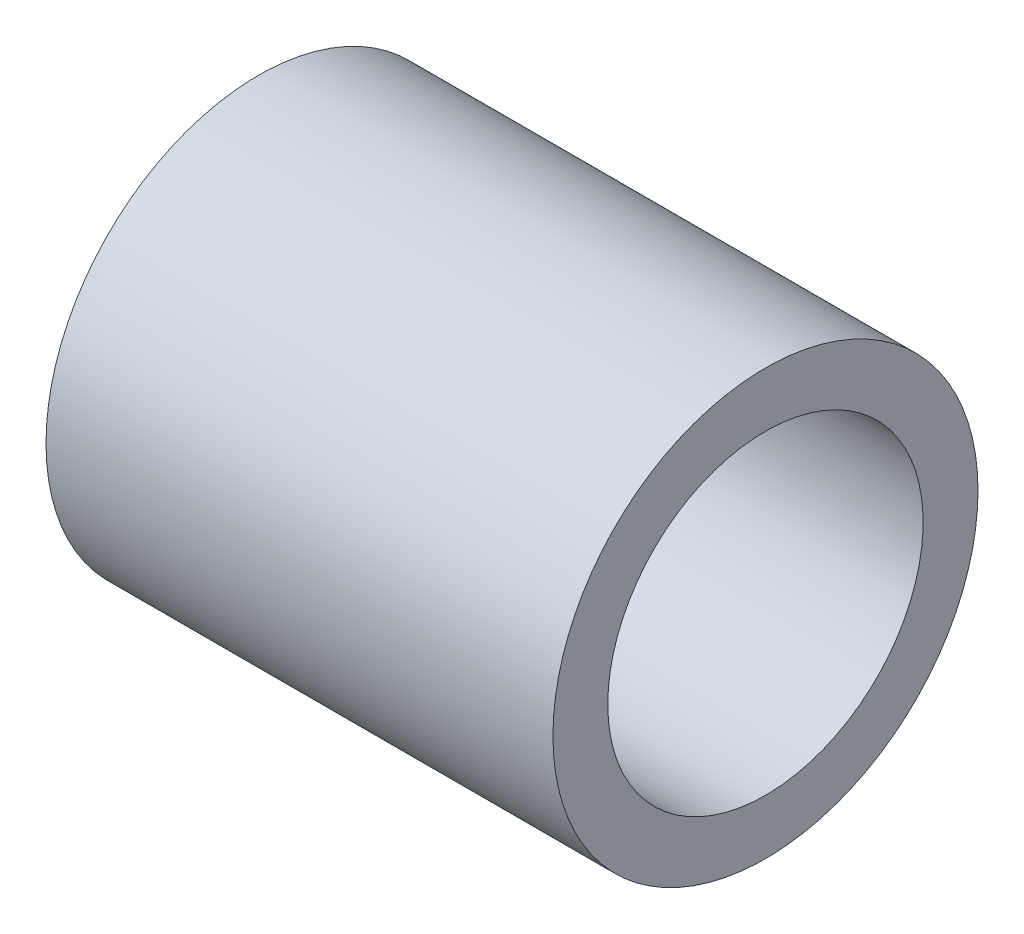
from build123d import *

# Parameters (mm, degrees)
CROQUIS1_R              = 10.65
CROQUIS1_R_2            = 7.9
SALIENTE_EXTRUIR1_DEPTH = 25.4


with BuildPart() as part:
    # Croquis1 → Saliente-Extruir1 (new body)
    with BuildSketch(Plane(origin=(0, 0, 0), x_dir=(0, 0, -1), z_dir=(1, 0, 0))):
        with Locations(Location((0, 0, 0), (0, 0, 180))):
            Circle(CROQUIS1_R)
        with Locations(Location((0, 0, 0), (0, 0, 180))):
            Circle(CROQUIS1_R_2, mode=Mode.SUBTRACT)
    extrude(amount=SALIENTE_EXTRUIR1_DEPTH)


solid = part.part
